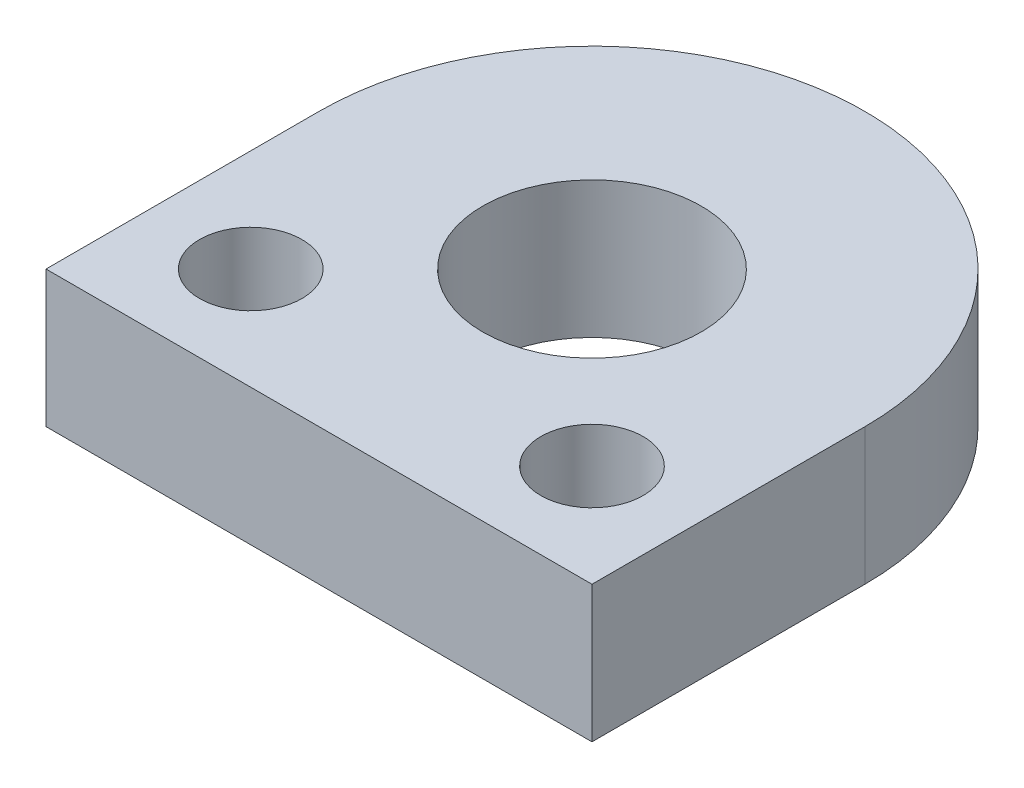
from build123d import *

# Parameters (mm, degrees)
SKETCH1_R          = 40
SKETCH1_W          = 80
SKETCH1_H          = 40
EXTRUDE1_DEPTH     = 20
SKETCH3_R          = 16
CUT_EXTRUDE1_DEPTH = 115.891252931
SKETCH7_R          = 7.5
CUT_EXTRUDE2_DEPTH = 115.891252931


with BuildPart() as part:
    # Sketch1 → Extrude1 (new body)
    with BuildSketch(Plane(origin=(0, 0, 0), x_dir=(1, 0, 0), z_dir=(0, 1, 0))):
        with Locations((40, 40)):
            Circle(SKETCH1_R)
        with Locations((40, 20)):
            Rectangle(SKETCH1_W, SKETCH1_H)
    extrude(amount=EXTRUDE1_DEPTH)

    # Sketch3 → Cut-Extrude1 (cut, through all)
    with BuildSketch(Plane(origin=(0, 20, 0), x_dir=(1, 0, 0), z_dir=(0, 1, 0))):
        with Locations(Location((40, 40, 0), (0, 0, 270))):
            Circle(SKETCH3_R)
    extrude(amount=-CUT_EXTRUDE1_DEPTH, mode=Mode.SUBTRACT)

    # Sketch7 → Cut-Extrude2 (cut, through all)
    with BuildSketch(Plane(origin=(0, 20, 0), x_dir=(1, 0, 0), z_dir=(0, 1, 0))):
        with Locations(Location((15, 15, 0), (0, 0, 270))):
            Circle(SKETCH7_R)
    cut_extrude2 = extrude(amount=-CUT_EXTRUDE2_DEPTH, mode=Mode.SUBTRACT)

    # Mirror1: Cut-Extrude2 across plane
    add(cut_extrude2.mirror(Plane(origin=(40, 0, 0), x_dir=(0, 0, 1), z_dir=(1, 0, 0))), mode=Mode.SUBTRACT)


solid = part.part
